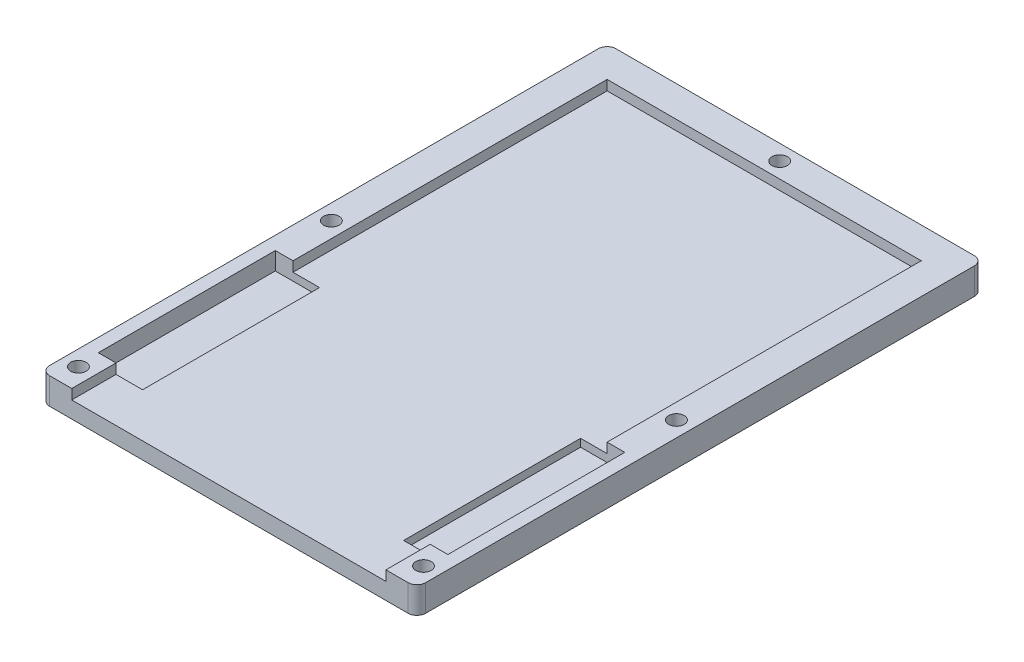
from build123d import *

# Parameters (mm, degrees)
SKETCH1_W                  = 85
SKETCH1_H                  = 128
TOP_LID_DEPTH              = 6
SKETCH2_R                  = 1.75
SCREW_HOLE_DEPTH           = 10
SKETCH5_R                  = 2.5
SCREW_HEAD_DEPTH           = 2
SCREW_HEAD_DRAFT           = -45
SCREW_HEAD_PROFILE_2_DEPTH = 2
SCREW_HEAD_PROFILE_2_DRAFT = -45
SCREW_HEAD_PROFILE_3_DEPTH = 2
SCREW_HEAD_PROFILE_3_DRAFT = -45
SCREW_HEAD_PROFILE_4_DEPTH = 2
SCREW_HEAD_PROFILE_4_DRAFT = -45
SCREW_HEAD_PROFILE_5_DEPTH = 2
SCREW_HEAD_PROFILE_5_DRAFT = -45
SKETCH6_W                  = 71
SKETCH6_H                  = 121
DEVICE_CUT_OUT_DEPTH       = 2.25
SKETCH7_W                  = 10
SKETCH7_H                  = 40
SLIDERS_DEPTH              = 4
FILLET1_R                  = 2
FILLET2_R                  = 2
FILLET3_R                  = 2
FILLET4_R                  = 2


with BuildPart() as part:
    # Sketch1 → Top Lid (new body)
    with BuildSketch(Plane(origin=(0, 0, 0), x_dir=(1, 0, 0), z_dir=(0, 1, 0))):
        Rectangle(SKETCH1_W, SKETCH1_H)
    extrude(amount=TOP_LID_DEPTH)

    # Sketch2 → Screw Hole (cut)
    with BuildSketch(Plane.XZ):
        with Locations(Location((39, 59, 0), (0, 0, 270))):
            Circle(SKETCH2_R)
        with Locations(Location((-39, 59, 0), (0, 0, 270))):
            Circle(SKETCH2_R)
        with Locations(Location((-39, 1.83, 0), (0, 0, 270))):
            Circle(SKETCH2_R)
        with Locations(Location((39, 1.83, 0), (0, 0, 270))):
            Circle(SKETCH2_R)
        with Locations(Location((0, -60.5, 0), (0, 0, 270))):
            Circle(SKETCH2_R)
    extrude(amount=-SCREW_HOLE_DEPTH, mode=Mode.SUBTRACT)


with BuildPart() as screw_head_tool:
    # Sketch5 → Screw Head (with draft: the straight prism first)
    with BuildSketch(Plane.XZ):
        with Locations((39, 59)):
            Circle(SKETCH5_R)
    extrude(amount=-SCREW_HEAD_DEPTH)
    # Screw Head: the draft: its side faces are tilted about the plane it starts from
    screw_head_sides = [screw_head_tool.faces().sort_by_distance(p)[0] for p in [
        (36.5, 1, 59),
    ]]
    draft(screw_head_sides, Plane.XZ, SCREW_HEAD_DRAFT)


with BuildPart() as part_1:
    add(part.part)

    # Screw Head: cut by screw_head_tool
    add(screw_head_tool.part, mode=Mode.SUBTRACT)


with BuildPart() as screw_head_profile_2_tool:
    # Sketch5 → Screw Head profile 2 (with draft: the straight prism first)
    with BuildSketch(Plane.XZ):
        with Locations((-39, 59)):
            Circle(SKETCH5_R)
    extrude(amount=-SCREW_HEAD_PROFILE_2_DEPTH)
    # Screw Head profile 2: the draft: its side faces are tilted about the plane it starts from
    screw_head_profile_2_sides = [screw_head_profile_2_tool.faces().sort_by_distance(p)[0] for p in [
        (-41.5, 1, 59),
    ]]
    draft(screw_head_profile_2_sides, Plane.XZ, SCREW_HEAD_PROFILE_2_DRAFT)


with BuildPart() as part_2:
    add(part_1.part)

    # Screw Head profile 2: cut by screw_head_profile_2_tool
    add(screw_head_profile_2_tool.part, mode=Mode.SUBTRACT)


with BuildPart() as screw_head_profile_3_tool:
    # Sketch5 → Screw Head profile 3 (with draft: the straight prism first)
    with BuildSketch(Plane.XZ):
        with Locations((-39, 1.83)):
            Circle(SKETCH5_R)
    extrude(amount=-SCREW_HEAD_PROFILE_3_DEPTH)
    # Screw Head profile 3: the draft: its side faces are tilted about the plane it starts from
    screw_head_profile_3_sides = [screw_head_profile_3_tool.faces().sort_by_distance(p)[0] for p in [
        (-41.5, 1, 1.83),
    ]]
    draft(screw_head_profile_3_sides, Plane.XZ, SCREW_HEAD_PROFILE_3_DRAFT)


with BuildPart() as part_3:
    add(part_2.part)

    # Screw Head profile 3: cut by screw_head_profile_3_tool
    add(screw_head_profile_3_tool.part, mode=Mode.SUBTRACT)


with BuildPart() as screw_head_profile_4_tool:
    # Sketch5 → Screw Head profile 4 (with draft: the straight prism first)
    with BuildSketch(Plane.XZ):
        with Locations((39, 1.83)):
            Circle(SKETCH5_R)
    extrude(amount=-SCREW_HEAD_PROFILE_4_DEPTH)
    # Screw Head profile 4: the draft: its side faces are tilted about the plane it starts from
    screw_head_profile_4_sides = [screw_head_profile_4_tool.faces().sort_by_distance(p)[0] for p in [
        (36.5, 1, 1.83),
    ]]
    draft(screw_head_profile_4_sides, Plane.XZ, SCREW_HEAD_PROFILE_4_DRAFT)


with BuildPart() as part_4:
    add(part_3.part)

    # Screw Head profile 4: cut by screw_head_profile_4_tool
    add(screw_head_profile_4_tool.part, mode=Mode.SUBTRACT)


with BuildPart() as screw_head_profile_5_tool:
    # Sketch5 → Screw Head profile 5 (with draft: the straight prism first)
    with BuildSketch(Plane.XZ):
        with Locations((0, -60.5)):
            Circle(SKETCH5_R)
    extrude(amount=-SCREW_HEAD_PROFILE_5_DEPTH)
    # Screw Head profile 5: the draft: its side faces are tilted about the plane it starts from
    screw_head_profile_5_sides = [screw_head_profile_5_tool.faces().sort_by_distance(p)[0] for p in [
        (-2.5, 1, -60.5),
    ]]
    draft(screw_head_profile_5_sides, Plane.XZ, SCREW_HEAD_PROFILE_5_DRAFT)


with BuildPart() as part_5:
    add(part_4.part)

    # Screw Head profile 5: cut by screw_head_profile_5_tool
    add(screw_head_profile_5_tool.part, mode=Mode.SUBTRACT)

    # Sketch6 → Device cut out (cut)
    with BuildSketch(Plane(origin=(0, 6, 0), x_dir=(1, 0, 0), z_dir=(0, 1, 0))):
        with Locations((0, -3.5)):
            Rectangle(SKETCH6_W, SKETCH6_H)
    extrude(amount=-DEVICE_CUT_OUT_DEPTH, mode=Mode.SUBTRACT)

    # Sketch7 → Sliders (cut)
    with BuildSketch(Plane(origin=(0, 6, 0), x_dir=(1, 0, 0), z_dir=(0, 1, 0))):
        with Locations((34.5, -34)):
            Rectangle(SKETCH7_W, SKETCH7_H)
        with Locations((-34.5, -34)):
            Rectangle(SKETCH7_W, SKETCH7_H)
    extrude(amount=-SLIDERS_DEPTH, mode=Mode.SUBTRACT)

    # Fillet1
    fillet1_edges = [part_5.edges().sort_by_distance(p)[0] for p in [
        (42.5, 3, 64),
    ]]
    fillet(fillet1_edges, radius=FILLET1_R)

    # Fillet2
    fillet2_edges = [part_5.edges().sort_by_distance(p)[0] for p in [
        (42.5, 3, -64),
    ]]
    fillet(fillet2_edges, radius=FILLET2_R)

    # Fillet3
    fillet3_edges = [part_5.edges().sort_by_distance(p)[0] for p in [
        (-42.5, 3, -64),
    ]]
    fillet(fillet3_edges, radius=FILLET3_R)

    # Fillet4
    fillet4_edges = [part_5.edges().sort_by_distance(p)[0] for p in [
        (-42.5, 3, 64),
    ]]
    fillet(fillet4_edges, radius=FILLET4_R)


solid = part_5.part
